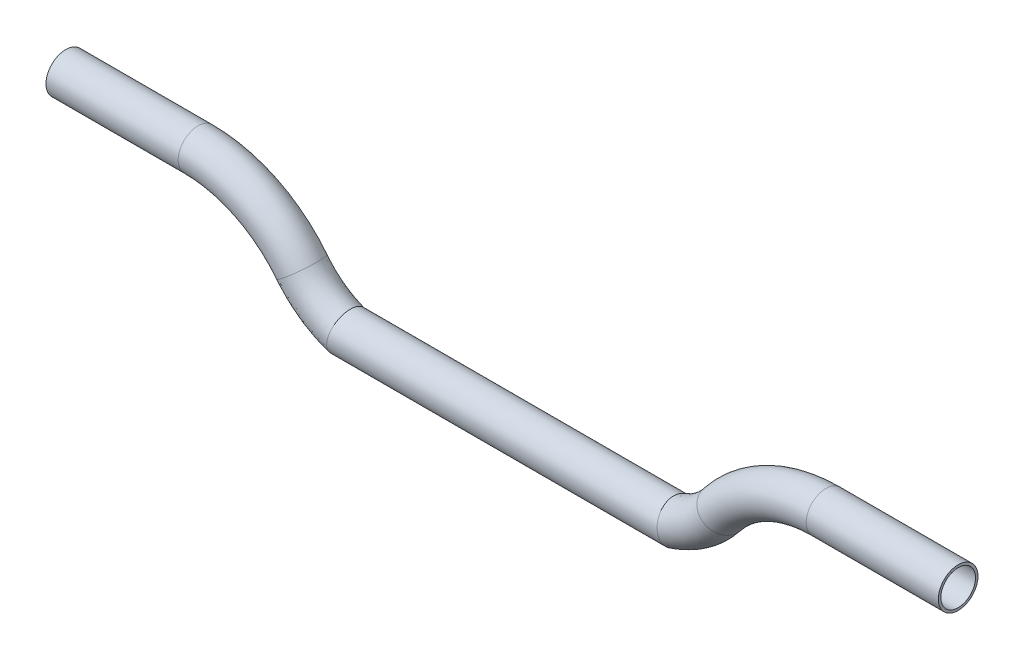
from build123d import *

# Parameters (mm, degrees)
SKETCH_2_R   = 12
SKETCH_2_R_2 = 10.5


with BuildPart() as part:
    # 扫描1: sweep along a path in 草图1
    with BuildLine(Plane.XY) as sweep_1_path:
        Line((-270.026757883, 50), (-190.026757883, 50))
        ThreePointArc((-190.026757883, 50), (-155.079791531, 41.963251335), (-127.154324807, 19.467738569))
        ThreePointArc((-127.154324807, 19.467738569), (-114.959605923, 7.805585717), (-100, 0))
        Line((-100, 0), (100, 0))
        ThreePointArc((100, 0), (114.959605923, 7.805585717), (127.154324807, 19.467738569))
        ThreePointArc((127.154324807, 19.467738569), (155.079791531, 41.963251335), (190.026757883, 50))
        Line((190.026757883, 50), (270.026757883, 50))
    # 草图2 → 扫描1 (sweep)
    with BuildSketch(Plane(origin=(-270.026757883, 0, 0), x_dir=(0, 0, -1), z_dir=(1, 0, 0))):
        with Locations((0, 50)):
            Circle(SKETCH_2_R)
        with Locations((0, 50)):
            Circle(SKETCH_2_R_2, mode=Mode.SUBTRACT)
    sweep(path=sweep_1_path.line, transition=Transition.RIGHT)


solid = part.part
